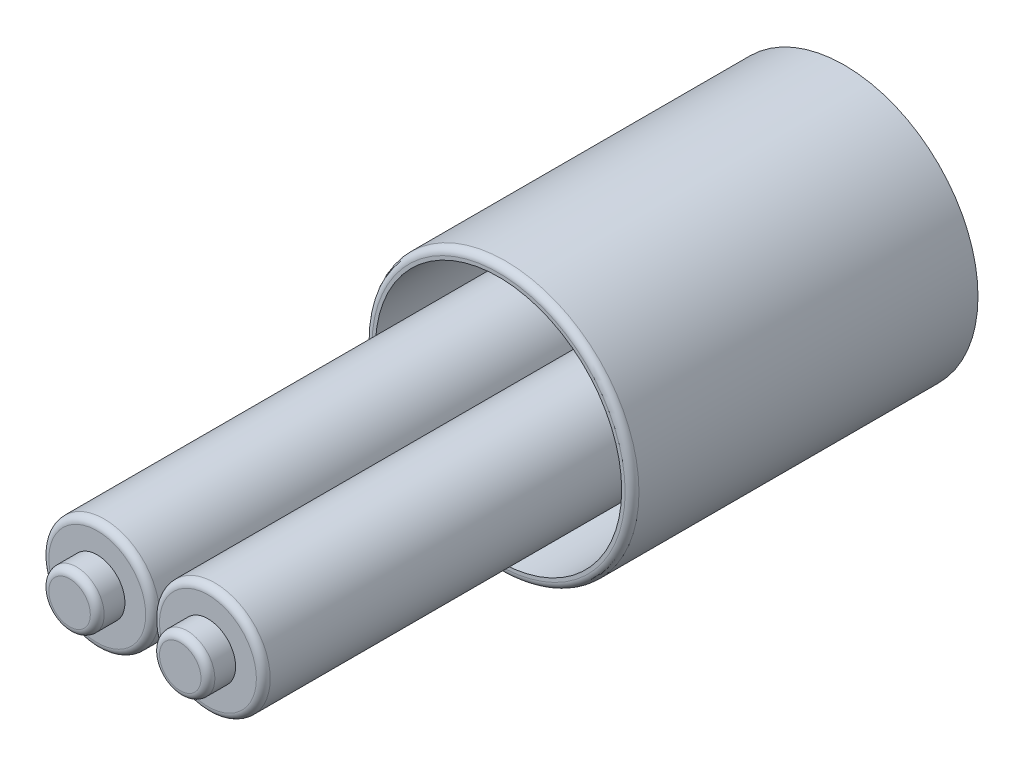
from build123d import *

# Parameters (mm, degrees)
SKETCH1_9_R           = 0.1016
SKETCH1_9_R_2         = 0.0508
BOSS_EXTRUDE3_DEPTH   = 1.27
BOSS_EXTRUDE3_2_DEPTH = 1.27
SKETCH1_R             = 0.24511
SKETCH1_R_2           = 0.22606
BOSS_EXTRUDE4_DEPTH   = 0.635
SKETCH1_12_R          = 0.0508
BOSS_EXTRUDE5_DEPTH   = 1.3208
FILLET3_R             = 0.0127
SKETCH1_14_R          = 0.0508
BOSS_EXTRUDE7_DEPTH   = 1.3208
FILLET4_R             = 0.0127
FILLET5_R             = 0.0127
FILLET6_R             = 0.0127
FILLET11_R            = 0.0127


with BuildPart() as part:
    # Sketch1<9> → Boss-Extrude3 (new body)
    with BuildSketch(Plane.XY):
        with Locations((-0.1016, 0.1016)):
            Circle(SKETCH1_9_R)
        with Locations((-0.1016, 0.1016)):
            Circle(SKETCH1_9_R_2, mode=Mode.SUBTRACT)
    extrude(amount=BOSS_EXTRUDE3_DEPTH)

    # Fillet6
    fillet6_edges = [part.edges().sort_by_distance(p)[0] for p in [
        (-0.2032, 0.1016, 1.27),
    ]]
    fillet(fillet6_edges, radius=FILLET6_R)


with BuildPart() as body_2:
    # Sketch1<9> → Boss-Extrude3 2 (new body)
    with BuildSketch(Plane.XY):
        with Locations((0.1016, 0.1016)):
            Circle(SKETCH1_9_R)
        with Locations((0.1016, 0.1016)):
            Circle(SKETCH1_9_R_2, mode=Mode.SUBTRACT)
    extrude(amount=BOSS_EXTRUDE3_2_DEPTH)

    # Fillet5
    fillet5_edges = [body_2.edges().sort_by_distance(p)[0] for p in [
        (0, 0.1016, 1.27),
    ]]
    fillet(fillet5_edges, radius=FILLET5_R)


with BuildPart() as body_3:
    # Sketch1 → Boss-Extrude4 (new body)
    with BuildSketch(Plane.XY):
        with Locations((0, 0.1016)):
            Circle(SKETCH1_R)
        with Locations((0, 0.1016)):
            Circle(SKETCH1_R_2, mode=Mode.SUBTRACT)
    extrude(amount=BOSS_EXTRUDE4_DEPTH)

    # Fillet11
    fillet11_edges = [body_3.edges().sort_by_distance(p)[0] for p in [
        (-0.24511, 0.1016, 0.635),
    ]]
    fillet(fillet11_edges, radius=FILLET11_R)


with BuildPart() as body_4:
    # Sketch1<12> → Boss-Extrude5 (new body)
    with BuildSketch(Plane.XY):
        with Locations((-0.1016, 0.1016)):
            Circle(SKETCH1_12_R)
    extrude(amount=BOSS_EXTRUDE5_DEPTH)

    # Fillet3
    fillet3_edges = [body_4.edges().sort_by_distance(p)[0] for p in [
        (-0.1524, 0.1016, 1.3208),
    ]]
    fillet(fillet3_edges, radius=FILLET3_R)


with BuildPart() as body_5:
    # Sketch1<14> → Boss-Extrude7 (new body)
    with BuildSketch(Plane.XY):
        with Locations((0.1016, 0.1016)):
            Circle(SKETCH1_14_R)
    extrude(amount=BOSS_EXTRUDE7_DEPTH)

    # Fillet4
    fillet4_edges = [body_5.edges().sort_by_distance(p)[0] for p in [
        (0.0508, 0.1016, 1.3208),
    ]]
    fillet(fillet4_edges, radius=FILLET4_R)


solid = Compound([part.part, body_2.part, body_3.part, body_4.part, body_5.part])
